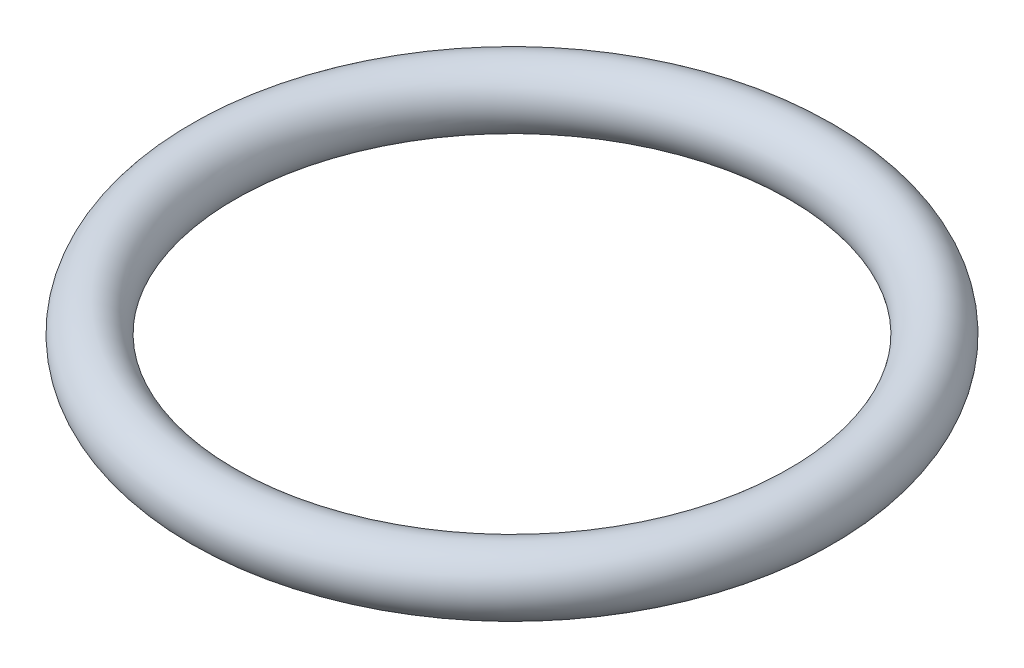
from build123d import *

# Parameters (mm, degrees)
SKETCH1_R = 0.5


with BuildPart() as part:
    # Sketch1 → Revolve1 (revolve)
    with BuildSketch(Plane.XY, mode=Mode.PRIVATE) as revolve1_sk:
        with Locations((-4.85, 0)):
            Circle(SKETCH1_R)
    revolve(revolve1_sk.sketch.rotate(Axis((0, 0, 0), (0, 1, 0)), 270), axis=Axis((0, 0, 0), (0, 1, 0)))


solid = part.part
